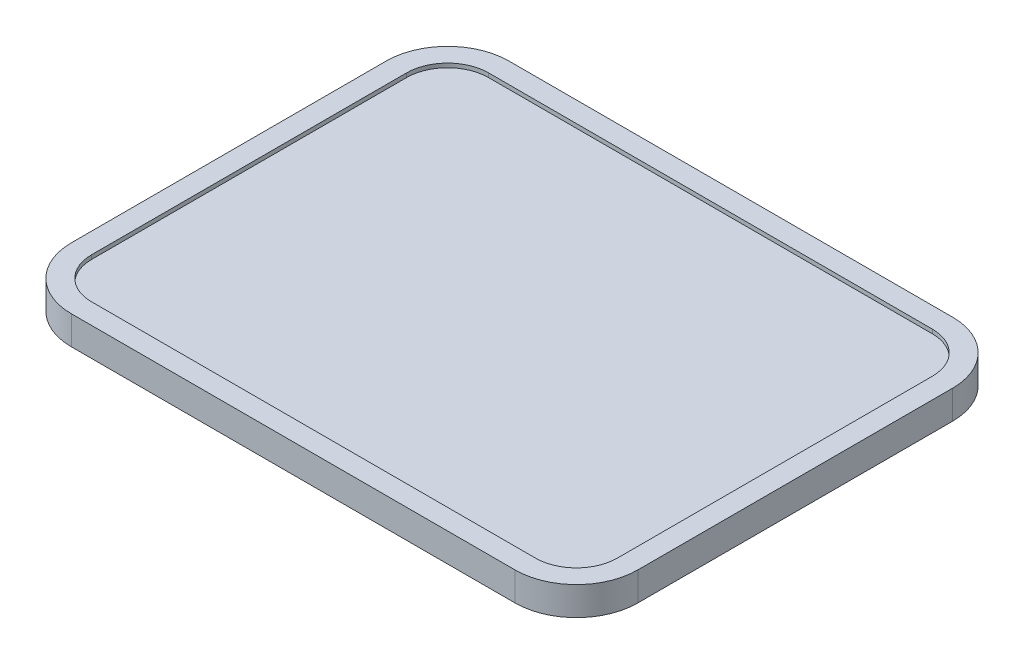
from build123d import *

# Parameters (mm, degrees)
SKETCH3_W           = 277
SKETCH3_H           = 214
BOSS_EXTRUDE1_DEPTH = 14
FILLET1_R           = 30
CUT_EXTRUDE1_DEPTH  = 2
CUT_EXTRUDE2_DEPTH  = 2


with BuildPart() as part:
    # Sketch3 → Boss-Extrude1 (new body)
    with BuildSketch(Plane(origin=(0, 0, 0), x_dir=(1, 0, 0), z_dir=(0, 1, 0))):
        Rectangle(SKETCH3_W, SKETCH3_H)
    extrude(amount=BOSS_EXTRUDE1_DEPTH)

    # Fillet1
    fillet1_edges = [part.edges().sort_by_distance(p)[0] for p in [
        (138.5, 7, 107),
        (-138.5, 7, 107),
        (-138.5, 7, -107),
        (138.5, 7, -107),
    ]]
    fillet(fillet1_edges, radius=FILLET1_R)

    # Sketch4 → Cut-Extrude1 (cut)
    with BuildSketch(Plane(origin=(0, 14, 0), x_dir=(1, 0, 0), z_dir=(0, 1, 0))):
        with BuildLine():
            Line((-128.5, 77), (-128.5, -77))
            ThreePointArc((-128.5, -77), (-122.642135624, -91.142135624), (-108.5, -97))
            Line((-108.5, -97), (108.5, -97))
            ThreePointArc((108.5, -97), (122.642135624, -91.142135624), (128.5, -77))
            Line((128.5, -77), (128.5, 77))
            ThreePointArc((128.5, 77), (122.642135624, 91.142135624), (108.5, 97))
            Line((108.5, 97), (-108.5, 97))
            ThreePointArc((-108.5, 97), (-122.642135624, 91.142135624), (-128.5, 77))
        make_face()
    extrude(amount=-CUT_EXTRUDE1_DEPTH, mode=Mode.SUBTRACT)

    # Sketch5 → Cut-Extrude2 (cut)
    with BuildSketch(Plane.XZ):
        Polygon((-104.5, 96), (104.5, 96), (104.5, 77), (128.5, 77), (128.5, 0), (128.5, -77), (104.5, -77), (104.5, -96), (-104.5, -96), (-104.5, -77), (-128.5, -77), (-128.5, 77), (-104.5, 77), align=None)
    extrude(amount=-CUT_EXTRUDE2_DEPTH, mode=Mode.SUBTRACT)


solid = part.part
